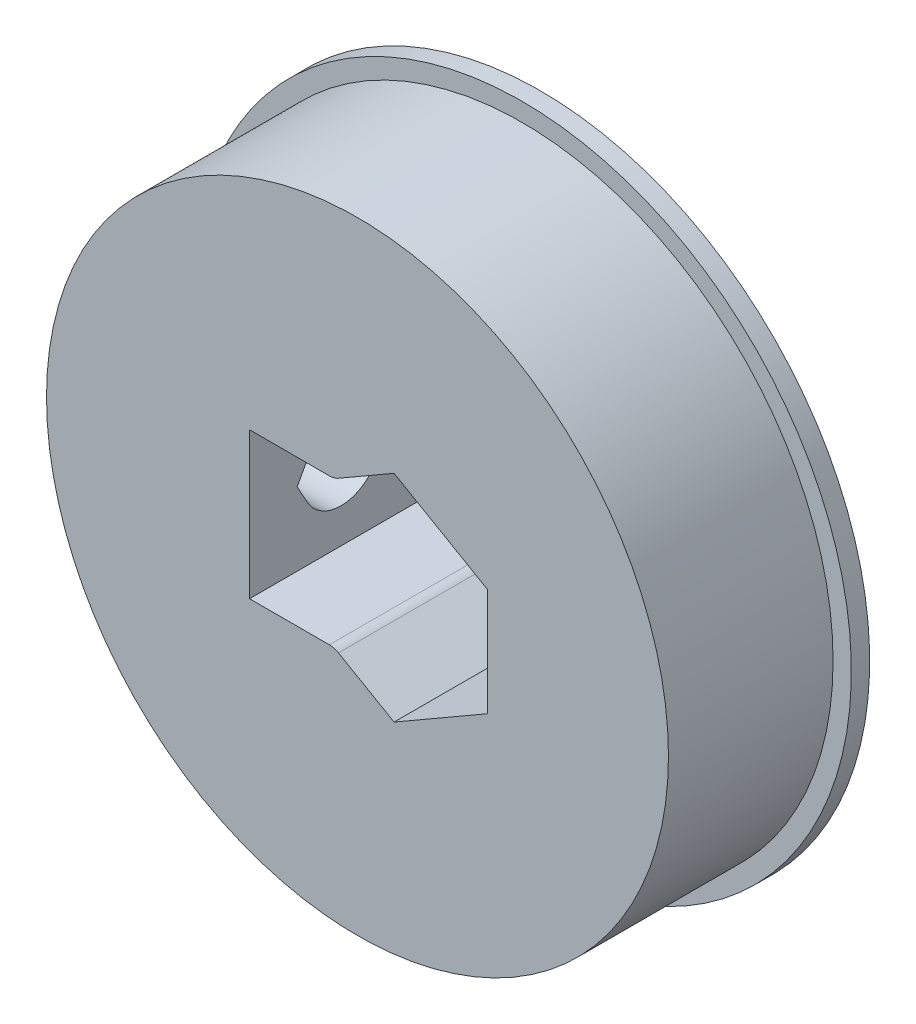
from build123d import *

# Parameters (mm, degrees)
SKETCH1_R                   = 8.5
BOSS_EXTRUDE1_DEPTH         = 5
M2_HEXNUT_CUTOUT_DEPTH      = 1.4
M2_HEXNUT_CUTOUT_DEPTH_BACK = 1.4
SKETCH2_W                   = 5
SKETCH2_H                   = 4
FILLET1_R                   = 0.5
M2_THRU_DEPTH               = 16.111336804
SKETCH4_R                   = 9
SKETCH4_R_2                 = 8.5
BOSS_EXTRUDE2_DEPTH         = 0.5


with BuildPart() as part:
    # Sketch1 → Boss-Extrude1 (new body)
    with BuildSketch(Plane.XY):
        with Locations((-1, 0)):
            Circle(SKETCH1_R)
        Polygon((0, -2.944486373), (2.55, -1.472243186), (2.55, 1.472243186), (0, 2.944486373), (-2.55, 1.472243186), (-2.55, -1.472243186), align=None, mode=Mode.SUBTRACT)
    extrude(amount=BOSS_EXTRUDE1_DEPTH)

    # Sketch2 → M2 Hexnut Cutout (cut, two sides: drawn at the far end of the back side and taken through both)
    with BuildSketch(Plane(origin=(-2.55, 0, 0), x_dir=(0, 0, -1), z_dir=(1, 0, 0)).offset(-M2_HEXNUT_CUTOUT_DEPTH_BACK)):
        with Locations((-2.5, 0)):
            Rectangle(SKETCH2_W, SKETCH2_H)
    extrude(amount=M2_HEXNUT_CUTOUT_DEPTH + M2_HEXNUT_CUTOUT_DEPTH_BACK, mode=Mode.SUBTRACT)

    # Fillet1
    fillet1_edges = [part.edges().sort_by_distance(p)[0] for p in [
        (-1.635898385, 2, 2.5),
        (-1.635898385, -2, 2.5),
    ]]
    fillet(fillet1_edges, radius=FILLET1_R)

    # Sketch3 → M2 Thru (cut, through all)
    with BuildSketch(Plane(origin=(-3.95, 0, 0), x_dir=(0, 0, -1), z_dir=(1, 0, 0))):
        with BuildLine():
            Line((-3.7, 0), (-3.41875, -0.508329064))
            ThreePointArc((-3.41875, -0.508329064), (-2.5, -1.05), (-1.58125, -0.508329064))
            Line((-1.58125, -0.508329064), (-1.3, 0))
            Line((-1.3, 0), (-1.58125, 0.508329064))
            ThreePointArc((-1.58125, 0.508329064), (-2.5, 1.05), (-3.41875, 0.508329064))
            Line((-3.41875, 0.508329064), (-3.7, 0))
        make_face()
    extrude(amount=-M2_THRU_DEPTH, mode=Mode.SUBTRACT)

    # Sketch4 → Boss-Extrude2 (add)
    with BuildSketch(Plane(origin=(0, 0, 0), x_dir=(-1, 0, 0), z_dir=(0, 0, -1))):
        with Locations((1, 0)):
            Circle(SKETCH4_R)
        with Locations((1, 0)):
            Circle(SKETCH4_R_2, mode=Mode.SUBTRACT)
    extrude(amount=-BOSS_EXTRUDE2_DEPTH)


solid = part.part
